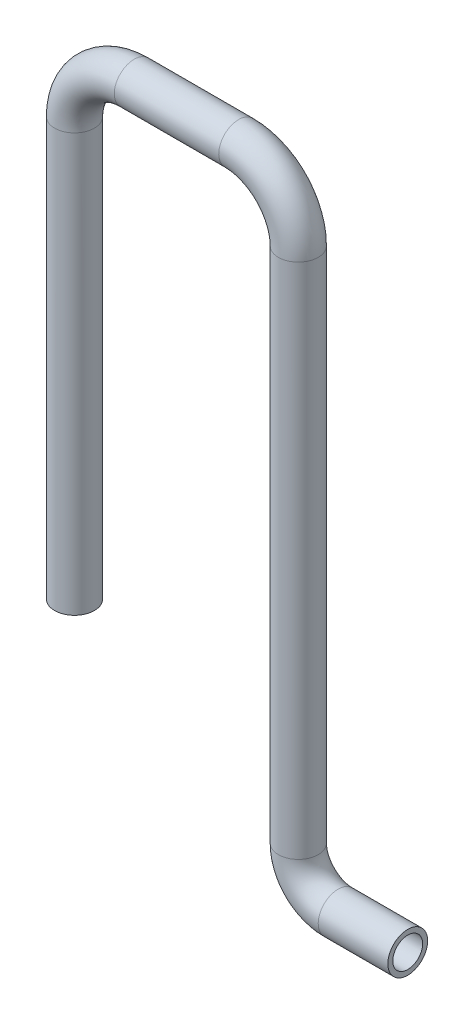
from build123d import *

# Parameters (mm, degrees)
TUBE_PROFILE_R   = 4
TUBE_PROFILE_R_2 = 3


with BuildPart() as part:
    # Tube: sweep along a curve in space
    with BuildLine() as tube_path:
        Line((-145, 44, 95), (-145, 128, 95))
        ThreePointArc((-133, 140, 95), (-141.485281374, 136.485281374, 95), (-145, 128, 95))
        Line((-133, 140, 95), (-112, 140, 95))
        ThreePointArc((-100, 128, 95), (-103.514718626, 136.485281374, 95), (-112, 140, 95))
        Line((-100, 128, 95), (-100, 24, 95))
        ThreePointArc((-92, 16, 95), (-97.656854249, 18.343145751, 95), (-100, 24, 95))
        Line((-92, 16, 95), (-78, 16, 95))
    # Tube profile (on start of the path) → Tube (sweep)
    with BuildSketch(Plane(origin=(-145, 44, 95), x_dir=(0, 0, 1), z_dir=(0, 1, 0))):
        Circle(TUBE_PROFILE_R)
        Circle(TUBE_PROFILE_R_2, mode=Mode.SUBTRACT)
    sweep(path=tube_path.line)


solid = part.part
